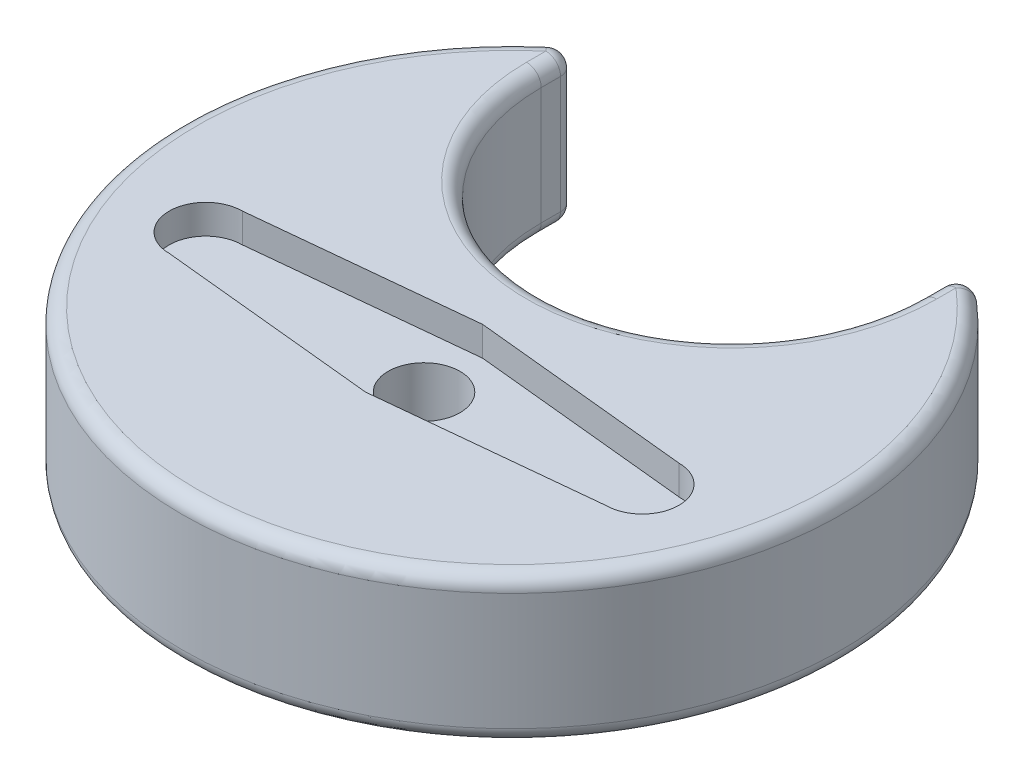
from build123d import *

# Parameters (mm, degrees)
BOSS_EXTRUDE1_DEPTH = 10
SKETCH4_R           = 2.452335066
CUT_EXTRUDE2_DEPTH  = 2
SKETCH4_2_R         = 2.452335066
CUT_EXTRUDE3_DEPTH  = 34.35416016
FILLET2_R           = 1


with BuildPart() as part:
    # Sketch2 → Boss-Extrude1 (new body)
    with BuildSketch(Plane(origin=(0, 0, 0), x_dir=(1, 0, 0), z_dir=(0, 1, 0))):
        with BuildLine():
            Line((-13, 15), (-13, 16.317168872))
            ThreePointArc((-13, 16.317168872), (-13.582365465, 17.22578397), (-14.651162791, 17.076106959))
            ThreePointArc((-14.651162791, 17.076106959), (0, -22.5), (14.651162791, 17.076106959))
            ThreePointArc((14.651162791, 17.076106959), (13.582365465, 17.22578397), (13, 16.317168872))
            Line((13, 16.317168872), (13, 15))
            ThreePointArc((13, 15), (0, 2), (-13, 15))
        make_face()
    extrude(amount=BOSS_EXTRUDE1_DEPTH)

    # Sketch4 → Cut-Extrude2 (cut)
    with BuildSketch(Plane(origin=(0, 10, 0), x_dir=(1, 0, 0), z_dir=(0, 1, 0))):
        with BuildLine():
            Line((-14.9, -3.5), (0, -2))
            Line((0, -2), (14.9, -3.5))
            ThreePointArc((14.9, -3.5), (17.4, -6), (14.9, -8.5))
            Line((14.9, -8.5), (0, -10))
            Line((0, -10), (-14.9, -8.5))
            ThreePointArc((-14.9, -8.5), (-17.4, -6), (-14.9, -3.5))
        make_face()
        with Locations((0, -6)):
            Circle(SKETCH4_R, mode=Mode.SUBTRACT)
    extrude(amount=-CUT_EXTRUDE2_DEPTH, mode=Mode.SUBTRACT)

    # Sketch4<2> → Cut-Extrude3 (cut, through all)
    with BuildSketch(Plane(origin=(0, 10, 0), x_dir=(1, 0, 0), z_dir=(0, 1, 0))):
        with Locations((0, -6)):
            Circle(SKETCH4_2_R)
    extrude(amount=-CUT_EXTRUDE3_DEPTH, mode=Mode.SUBTRACT)

    # Fillet2
    fillet2_edges = [part.edges().sort_by_distance(p)[0] for p in [
        (0, 0, 22.5),
        (0, 10, 22.5),
        (0, 0, -2),
        (13, 0, -15.658584436),
        (0, 10, -2),
        (13, 10, -15.658584436),
        (-13, 0, -15.658584436),
        (-13.582365465, 0, -17.22578397),
        (13.582365465, 0, -17.22578397),
        (-13, 10, -15.658584436),
        (-13.582365465, 10, -17.22578397),
        (13.582365465, 10, -17.22578397),
    ]]
    fillet(fillet2_edges, radius=FILLET2_R)


solid = part.part
